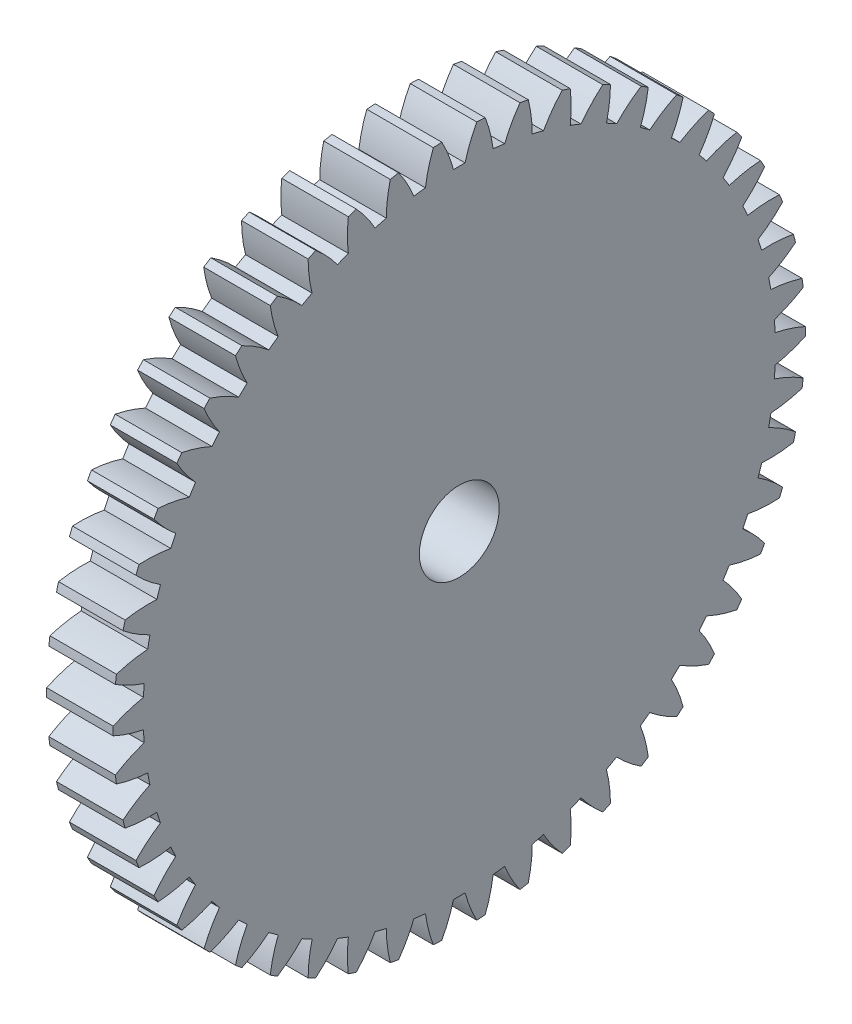
from build123d import *

# Parameters (mm, degrees)
BASPROSKE_W        = 2.5
BASPROSKE_H        = 13
TOOTHCUT_DEPTH     = 19.553975315
TEETHCUTS_COUNT    = 50
HUBNEAONESKE_R     = 3
HUBNEARONE_DEPTH   = 4.0000508
BORSKE_R           = 1.5
BORE_DEPTH         = 6.5000508
CUT_EXTRUDE1_START = -4.0000508
CUT_EXTRUDE1_DEPTH = 4.0000508
CIRPATTERN2_COUNT  = 10


with BuildPart() as part:
    # BasProSke → Base-Revolve (revolve)
    with BuildSketch(Plane(origin=(0, 0, 0), x_dir=(1, 0, 0), z_dir=(0, 1, 0)), mode=Mode.PRIVATE) as base_revolve_sk:
        with Locations((1.25, 6.5)):
            Rectangle(BASPROSKE_W, BASPROSKE_H)
    revolve(base_revolve_sk.sketch.rotate(Axis((-10, 0, 0), (1, 0, 0)), 180), axis=Axis((-10, 0, 0), (1, 0, 0)))

    # TooCutSke → ToothCut (cut, through all)
    with BuildSketch(Plane(origin=(0, 0, 0), x_dir=(0, 0, -1), z_dir=(1, 0, 0))):
        with BuildLine():
            ThreePointArc((0.218701072, 11.871985758), (0, 11.874), (-0.218701072, 11.871985758))
            ThreePointArc((-0.218701072, 11.871985758), (-0.410224227, 12.453928998), (-0.671481128, 13.008080498))
            ThreePointArc((-0.671481128, 13.008080498), (0, 13.0254), (0.671481128, 13.008080498))
            ThreePointArc((0.671481128, 13.008080498), (0.410224227, 12.453928998), (0.218701072, 11.871985758))
        make_face()
    toothcut = extrude(amount=TOOTHCUT_DEPTH, mode=Mode.SUBTRACT)

    # TeethCuts: ToothCut ×50 about axis
    teethcuts_axis = Axis((0, 0, 0), (1, 0, 0))
    for i in range(1, TEETHCUTS_COUNT):
        add(toothcut.rotate(teethcuts_axis, i * 360 / TEETHCUTS_COUNT), mode=Mode.SUBTRACT)

    # HubNeaOneSke → HubNearOne (add)
    with BuildSketch(Plane.ZY):
        with Locations(Location((0, 0, 0), (0, 0, 180))):
            Circle(HUBNEAONESKE_R)
    extrude(amount=HUBNEARONE_DEPTH)

    # BorSke → Bore (cut, symmetric)
    with BuildSketch(Plane(origin=(0, 0, 0), x_dir=(0, 0, -1), z_dir=(1, 0, 0))):
        with Locations(Location((0, 0, 0), (0, 0, 180))):
            Circle(BORSKE_R)
    extrude(amount=BORE_DEPTH, both=True, mode=Mode.SUBTRACT)

    # Sketch1 → Cut-Extrude1 (cut)
    with BuildSketch(Plane.ZY.offset(4.0000508).offset(CUT_EXTRUDE1_START)):
        with BuildLine():
            ThreePointArc((0.218701072, 1.846591317), (0, 1.8486), (-0.218701072, 1.846591317))
            ThreePointArc((-0.218701072, 1.846591317), (-0.360801789, 2.299375439), (-0.545188589, 2.736648331))
            ThreePointArc((-0.545188589, 2.736648331), (-0.624652879, 2.84180799), (-0.738872544, 2.907587894))
            ThreePointArc((-0.738872544, 2.907587894), (0, 3), (0.738872544, 2.907587894))
            ThreePointArc((0.738872544, 2.907587894), (0.624652879, 2.84180799), (0.545188589, 2.736648331))
            ThreePointArc((0.545188589, 2.736648331), (0.360801789, 2.299375439), (0.218701072, 1.846591317))
        make_face()
    cut_extrude1 = extrude(amount=CUT_EXTRUDE1_DEPTH, mode=Mode.SUBTRACT)

    # CirPattern2: Cut-Extrude1 ×10 about axis
    cirpattern2_axis = Axis((0, 0, 0), (1, 0, 0))
    for i in range(1, CIRPATTERN2_COUNT):
        add(cut_extrude1.rotate(cirpattern2_axis, i * 360 / CIRPATTERN2_COUNT), mode=Mode.SUBTRACT)


solid = part.part
